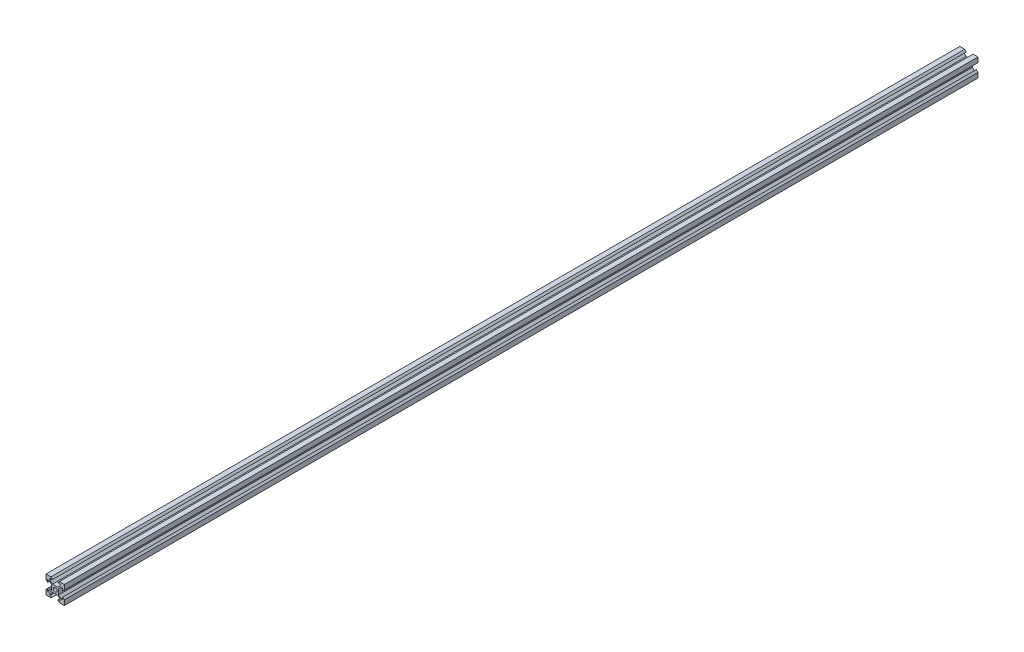
from build123d import *

# Parameters (mm, degrees)
SKETCH1_R           = 2.1
BOSS_EXTRUDE1_DEPTH = 1000


with BuildPart() as part:
    # Sketch1 → Boss-Extrude1 (new body)
    with BuildSketch(Plane.XY):
        Polygon((-4.58, 10), (-2.885, 8.2), (-5.5, 8.2), (-5.5, 6.560660172), (-2.839339828, 3.9), (2.839339828, 3.9), (5.5, 6.560660172), (5.5, 8.2), (2.885, 8.2), (4.58, 10), (10, 10), (10, 4.58), (8.2, 2.885), (8.2, 5.5), (6.560660172, 5.5), (3.9, 2.839339828), (3.9, -2.839339828), (6.560660172, -5.5), (8.2, -5.5), (8.2, -2.885), (10, -4.58), (10, -10), (4.58, -10), (2.885, -8.2), (5.5, -8.2), (5.5, -6.560660172), (2.839339828, -3.9), (-2.839339828, -3.9), (-5.5, -6.560660172), (-5.5, -8.2), (-2.885, -8.2), (-4.58, -10), (-10, -10), (-10, -4.58), (-8.2, -2.885), (-8.2, -5.5), (-6.560660172, -5.5), (-3.9, -2.839339828), (-3.9, 2.839339828), (-6.560660172, 5.5), (-8.2, 5.5), (-8.2, 2.885), (-10, 4.58), (-10, 10), align=None)
        Circle(SKETCH1_R, mode=Mode.SUBTRACT)
    extrude(amount=BOSS_EXTRUDE1_DEPTH)


solid = part.part
